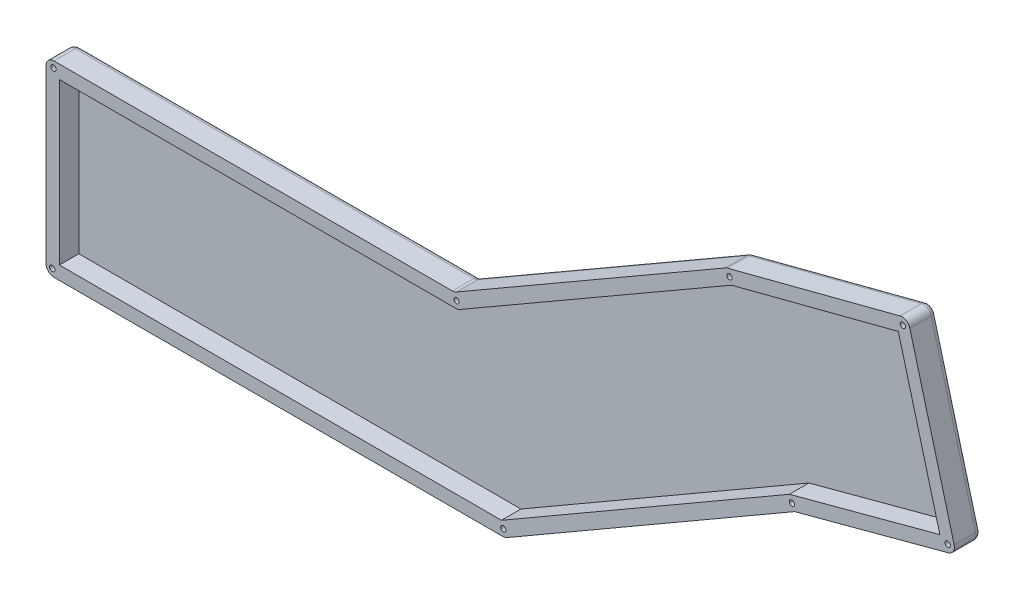
from build123d import *

# Parameters (mm, degrees)
BOSS_EXTRU_1_DEPTH      = 10
CONG_1_R                = 3
BOSS_EXTRU_2_DEPTH      = 2.7
CONG_2_R                = 2
ESQUISSE3_R             = 1
ENL_V_MAT_EXTRU_1_DEPTH = 20
ESQUISSE4_R             = 2
ENL_V_MAT_EXTRU_2_DEPTH = 2


with BuildPart() as part:
    # Model → Boss.-Extru.1 (new body)
    with BuildSketch(Plane.XY):
        Polygon((-26.464533767, 12.30154537), (75.33141454, 71.077500491), (143.246352653, 88.745859712), (161.383942986, 21.020985262), (100.854480283, 4.809102496), (-7.520422715, -57.858487698), (-179.373873722, -57.858487698), (-179.373873722, -50.687645053), (-179.373873722, 12.291034855), align=None)
        Polygon((-25.124548608, 7.301637465), (-174.373873722, 7.291378528), (-174.373873722, -50.687645053), (-174.373873722, -52.858487698), (-8.861972593, -52.858487698), (98.923133978, 9.468053786), (155.26069475, 24.557200291), (139.700811798, 82.657041562), (77.245358051, 66.408990356), align=None, mode=Mode.SUBTRACT)
    extrude(amount=BOSS_EXTRU_1_DEPTH)

    # Congé1
    cong_1_edges = [part.edges().sort_by_distance(p)[0] for p in [
        (75.33141454, 71.077500491, 5),
        (143.246352653, 88.745859712, 5),
        (161.383942986, 21.020985262, 5),
        (100.854480283, 4.809102496, 5),
        (-7.520422715, -57.858487698, 5),
        (-179.373873722, -57.858487698, 5),
        (-179.373873722, 12.291034855, 5),
        (-26.464533767, 12.30154537, 5),
    ]]
    fillet(cong_1_edges, radius=CONG_1_R)

    # Esquisse1 → Boss.-Extru.2 (add)
    with BuildSketch(Plane.XY):
        Polygon((-25.124548608, 7.301637465), (-174.373873722, 7.291378528), (-174.373873722, -50.687645053), (-174.373873722, -52.858487698), (-8.861972593, -52.858487698), (98.923133978, 9.468053786), (155.26069475, 24.557200291), (139.700811798, 82.657041562), (77.245358051, 66.408990356), align=None)
    extrude(amount=BOSS_EXTRU_2_DEPTH)

    # Congé2
    cong_2_edges = [part.edges().sort_by_distance(p)[0] for p in [
        (-101.821199292, 12.296365586, 0),
        (24.605627892, 41.788942262, 0),
        (108.044083383, 79.587840046, 0),
        (152.312387337, 54.893729991, 0),
        (129.861641055, 12.578223, 0),
        (46.843967712, -26.422377988, 0),
        (-92.349613182, -57.858487698, 0),
        (-179.373873722, -22.78362332, 0),
        (-178.495266971, 11.412488494, 0),
        (-178.495194066, -56.979808041, 0),
        (-7.547920203, -57.756003669, 0),
        (160.307894606, 21.642410085, 0),
        (142.628648998, 87.685066626, 0),
        (75.341794938, 71.05218052, 0),
        (-26.491925042, 12.40375087, 0),
        (100.86445313, 4.78504518, 0),
    ]]
    fillet(cong_2_edges, radius=CONG_2_R)

    # Esquisse3 → Enlèv. mat.-Extru.1 (cut)
    with BuildSketch(Plane.XY):
        with Locations(Location((158.201617013, 22.958080812, 0), (0, 0, 238.978237888))):
            Circle(ESQUISSE3_R)
        with Locations(Location((141.388472611, 85.534334234, 0), (0, 0, 154.767958728))):
            Circle(ESQUISSE3_R)
        with Locations(Location((76.500226548, 68.776582274, 0), (0, 0, 174.757995249))):
            Circle(ESQUISSE3_R)
        with Locations(Location((99.890442316, 7.071415488, 0), (0, 0, 236.208794577))):
            Circle(ESQUISSE3_R)
        with Locations(Location((-8.172352823, -55.275906246, 0), (0, 0, 215.632313771))):
            Circle(ESQUISSE3_R)
        with Locations(Location((-25.691359515, 9.920090126, 0), (0, 0, 154.730246838))):
            Circle(ESQUISSE3_R)
        with Locations(Location((-176.562127678, 9.920090126, 0), (0, 0, 215.825985053))):
            Circle(ESQUISSE3_R)
        with Locations(Location((-177.029598341, -55.275906246, 0), (0, 0, 155.328283389))):
            Circle(ESQUISSE3_R)
    extrude(amount=ENL_V_MAT_EXTRU_1_DEPTH, mode=Mode.SUBTRACT)

    # Esquisse4 → Enlèv. mat.-Extru.2 (cut)
    with BuildSketch(Plane(origin=(0, 0, 0), x_dir=(-1, 0, 0), z_dir=(0, 0, -1))):
        with Locations((177.029598341, -55.275906246)):
            Circle(ESQUISSE4_R)
        with Locations((176.562127678, 9.920090126)):
            Circle(ESQUISSE4_R)
        with Locations((25.691359515, 9.920090126)):
            Circle(ESQUISSE4_R)
        with Locations((-76.500226548, 68.776582274)):
            Circle(ESQUISSE4_R)
        with Locations((-141.388472611, 85.534334234)):
            Circle(ESQUISSE4_R)
        with Locations((-158.201617013, 22.958080812)):
            Circle(ESQUISSE4_R)
        with Locations((-99.890442316, 7.071415488)):
            Circle(ESQUISSE4_R)
        with Locations((8.172352823, -55.275906246)):
            Circle(ESQUISSE4_R)
    extrude(amount=-ENL_V_MAT_EXTRU_2_DEPTH, mode=Mode.SUBTRACT)


solid = part.part
